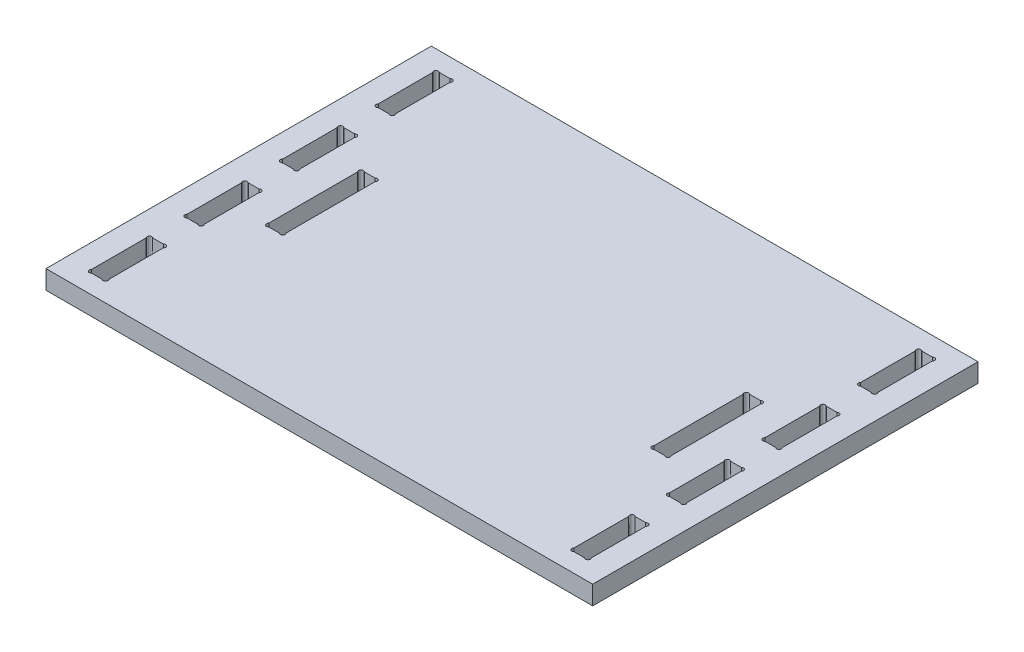
from build123d import *

# Parameters (mm, degrees)
CROQUIS1_W              = 349.003555023
CROQUIS1_H              = 246
SALIENTE_EXTRUIR1_DEPTH = 12


with BuildPart() as part:
    # Croquis1 → Saliente-Extruir1 (new body)
    with BuildSketch(Plane(origin=(0, 0, 0), x_dir=(1, 0, 0), z_dir=(0, 1, 0))):
        with Locations((174.501777512, -123)):
            Rectangle(CROQUIS1_W, CROQUIS1_H)
        with BuildLine():
            Line((17.121320344, -173), (23.878679656, -173))
            ThreePointArc((23.878679656, -173), (26, -173), (26, -170.878679656))
            Line((26, -170.878679656), (26, -136.121320344))
            ThreePointArc((26, -136.121320344), (26, -134), (23.878679656, -134))
            Line((23.878679656, -134), (17.121320344, -134))
            ThreePointArc((17.121320344, -134), (15, -134), (15, -136.121320344))
            Line((15, -136.121320344), (15, -170.878679656))
            ThreePointArc((15, -170.878679656), (15, -173), (17.121320344, -173))
        make_face(mode=Mode.SUBTRACT)
        with BuildLine():
            Line((46, -149.757359313), (46, -93.058131736))
            ThreePointArc((46, -93.058131736), (45.941048988, -90.937630668), (48.061550056, -90.878679656))
            Line((48.061550056, -90.878679656), (54.878679656, -90.878679656))
            ThreePointArc((54.878679656, -90.878679656), (57, -90.878679656), (57, -93))
            Line((57, -93), (57, -149.757359313))
            ThreePointArc((57, -149.757359313), (57, -151.878679656), (54.878679656, -151.878679656))
            Line((54.878679656, -151.878679656), (48.121320344, -151.878679656))
            ThreePointArc((48.121320344, -151.878679656), (46, -151.878679656), (46, -149.757359313))
        make_face(mode=Mode.SUBTRACT)
        with BuildLine():
            Line((17.121320344, -112), (23.878679656, -112))
            ThreePointArc((23.878679656, -112), (26, -112), (26, -109.878679656))
            Line((26, -109.878679656), (26, -75.121320344))
            ThreePointArc((26, -75.121320344), (26, -73), (23.878679656, -73))
            Line((23.878679656, -73), (17.121320344, -73))
            ThreePointArc((17.121320344, -73), (15, -73), (15, -75.121320344))
            Line((15, -75.121320344), (15, -109.878679656))
            ThreePointArc((15, -109.878679656), (15, -112), (17.121320344, -112))
        make_face(mode=Mode.SUBTRACT)
        with BuildLine():
            Line((26, -231.878679656), (26, -197.121320344))
            ThreePointArc((26, -197.121320344), (26, -195), (23.878679656, -195))
            Line((23.878679656, -195), (17.121320344, -195))
            ThreePointArc((17.121320344, -195), (15, -195), (15, -197.121320344))
            Line((15, -197.121320344), (15, -231.878679656))
            ThreePointArc((15, -231.878679656), (15, -234), (17.121320344, -234))
            Line((17.121320344, -234), (23.878679656, -234))
            ThreePointArc((23.878679656, -234), (26, -234), (26, -231.878679656))
        make_face(mode=Mode.SUBTRACT)
        with BuildLine():
            Line((17.121320344, -51), (23.878679656, -51))
            ThreePointArc((23.878679656, -51), (26, -51), (26, -48.878679656))
            Line((26, -48.878679656), (26, -14.121320344))
            ThreePointArc((26, -14.121320344), (26, -12), (23.878679656, -12))
            Line((23.878679656, -12), (17.121320344, -12))
            ThreePointArc((17.121320344, -12), (15, -12), (15, -14.121320344))
            Line((15, -14.121320344), (15, -48.878679656))
            ThreePointArc((15, -48.878679656), (15, -51), (17.121320344, -51))
        make_face(mode=Mode.SUBTRACT)
        with BuildLine():
            Line((331.88223468, -234), (325.124875367, -234))
            ThreePointArc((325.124875367, -234), (323.003555023, -234), (323.003555023, -231.878679656))
            Line((323.003555023, -231.878679656), (323.003555023, -197.121320344))
            ThreePointArc((323.003555023, -197.121320344), (323.003555023, -195), (325.124875367, -195))
            Line((325.124875367, -195), (331.88223468, -195))
            ThreePointArc((331.88223468, -195), (334.003555023, -195), (334.003555023, -197.121320344))
            Line((334.003555023, -197.121320344), (334.003555023, -231.878679656))
            ThreePointArc((334.003555023, -231.878679656), (334.003555023, -234), (331.88223468, -234))
        make_face(mode=Mode.SUBTRACT)
        with BuildLine():
            Line((325.124875367, -173), (331.88223468, -173))
            ThreePointArc((331.88223468, -173), (334.003555023, -173), (334.003555023, -170.878679656))
            Line((334.003555023, -170.878679656), (334.003555023, -136.121320344))
            ThreePointArc((334.003555023, -136.121320344), (334.003555023, -134), (331.88223468, -134))
            Line((331.88223468, -134), (325.124875367, -134))
            ThreePointArc((325.124875367, -134), (323.003555023, -134), (323.003555023, -136.121320344))
            Line((323.003555023, -136.121320344), (323.003555023, -170.878679656))
            ThreePointArc((323.003555023, -170.878679656), (323.003555023, -173), (325.124875367, -173))
        make_face(mode=Mode.SUBTRACT)
        with BuildLine():
            Line((325.124875367, -112), (331.88223468, -112))
            ThreePointArc((331.88223468, -112), (334.003555023, -112), (334.003555023, -109.878679656))
            Line((334.003555023, -109.878679656), (334.003555023, -75.121320344))
            ThreePointArc((334.003555023, -75.121320344), (334.003555023, -73), (331.88223468, -73))
            Line((331.88223468, -73), (325.124875367, -73))
            ThreePointArc((325.124875367, -73), (323.003555023, -73), (323.003555023, -75.121320344))
            Line((323.003555023, -75.121320344), (323.003555023, -109.878679656))
            ThreePointArc((323.003555023, -109.878679656), (323.003555023, -112), (325.124875367, -112))
        make_face(mode=Mode.SUBTRACT)
        with BuildLine():
            Line((325.124875367, -51), (331.88223468, -51))
            ThreePointArc((331.88223468, -51), (334.003555023, -51), (334.003555023, -48.878679656))
            Line((334.003555023, -48.878679656), (334.003555023, -14.121320344))
            ThreePointArc((334.003555023, -14.121320344), (334.003555023, -12), (331.88223468, -12))
            Line((331.88223468, -12), (325.124875367, -12))
            ThreePointArc((325.124875367, -12), (323.003555023, -12), (323.003555023, -14.121320344))
            Line((323.003555023, -14.121320344), (323.003555023, -48.878679656))
            ThreePointArc((323.003555023, -48.878679656), (323.003555023, -51), (325.124875367, -51))
        make_face(mode=Mode.SUBTRACT)
        with BuildLine():
            Line((303.003555023, -149.757359313), (303.003555023, -93))
            ThreePointArc((303.003555023, -93), (303.003555023, -90.878679656), (300.88223468, -90.878679656))
            Line((300.88223468, -90.878679656), (294.124875367, -90.878679656))
            ThreePointArc((294.124875367, -90.878679656), (292.003555023, -90.878679656), (292.003555023, -93))
            Line((292.003555023, -93), (292.003555023, -149.757359313))
            ThreePointArc((292.003555023, -149.757359313), (292.003555023, -151.878679656), (294.124875367, -151.878679656))
            Line((294.124875367, -151.878679656), (300.88223468, -151.878679656))
            ThreePointArc((300.88223468, -151.878679656), (303.003555023, -151.878679656), (303.003555023, -149.757359313))
        make_face(mode=Mode.SUBTRACT)
    extrude(amount=SALIENTE_EXTRUIR1_DEPTH)


solid = part.part
